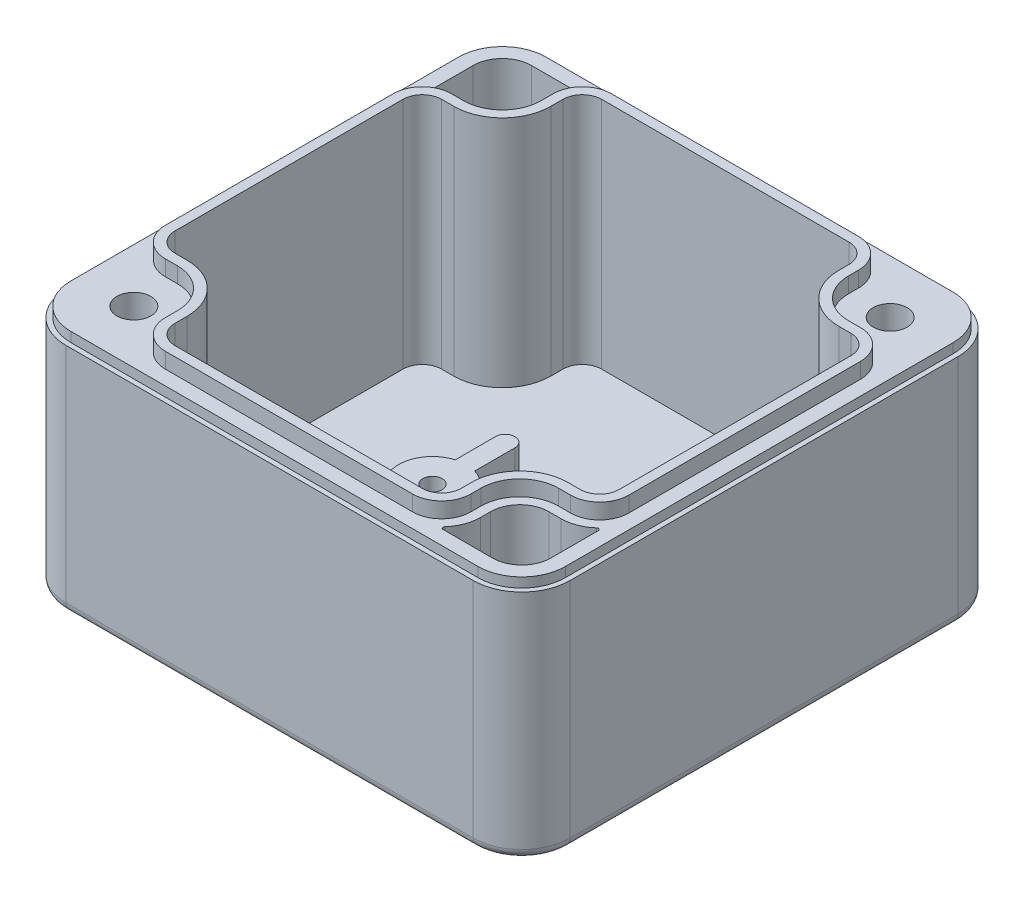
from build123d import *

# Parameters (mm, degrees)
EXTRUDE_1_DEPTH       = 25
CUT_EXTRUDE_START     = 2.5
CUT_EXTRUDE_1_DEPTH   = 22.5
CUT_EXTRUDE_START_2   = 3
CUT_EXTRUDE_3_DEPTH   = 22
EXTRUDE_START         = 25
EXTRUDE_1_2_DEPTH     = 1.6
CUT_EXTRUDE_START_3   = 25
CUT_EXTRUDE_1_2_DEPTH = 1
FILLET_1_R            = 0.2
SKETCH_9_R            = 2.25
CUT_EXTRUDE_4_DEPTH   = 4
SKETCH_10_R           = 4
CUT_EXTRUDE_5_DEPTH   = 17
FILLET_2_R            = 1
SKETCH_11_R           = 1.75
CUT_EXTRUDE_6_DEPTH   = 25
EXTRUDE_2_DEPTH       = 5.5
SKETCH_13_R           = 3.5
EXTRUDE_3_DEPTH       = 5.5
SKETCH_14_R           = 1
CUT_EXTRUDE_7_DEPTH   = 4.5


with BuildPart() as part:
    # Эскиз1 → Extrude 1 (new body)
    with BuildSketch(Plane(origin=(0, 0, 0), x_dir=(1, 0, 0), z_dir=(0, 1, 0))):
        with BuildLine():
            Line((-21, 25), (21, 25))
            ThreePointArc((21, 25), (24.535533906, 23.535533906), (26, 20))
            Line((26, 20), (26, -20))
            ThreePointArc((26, -20), (24.535533906, -23.535533906), (21, -25))
            Line((21, -25), (-21, -25))
            ThreePointArc((-21, -25), (-24.535533906, -23.535533906), (-26, -20))
            Line((-26, -20), (-26, 20))
            ThreePointArc((-26, 20), (-24.535533906, 23.535533906), (-21, 25))
        make_face()
    extrude(amount=EXTRUDE_1_DEPTH)

    # Эскиз2 → Cut-Extrude 1 (cut)
    with BuildSketch(Plane(origin=(0, 0, 0), x_dir=(1, 0, 0), z_dir=(0, 1, 0)).offset(CUT_EXTRUDE_START)):
        with BuildLine():
            Line((-14.75, 20), (-14.75, 18.75))
            ThreePointArc((-14.75, 18.75), (-16.214466094, 15.214466094), (-19.75, 13.75))
            Line((-19.75, 13.75), (-21, 13.75))
            ThreePointArc((-21, 13.75), (-22.414213562, 13.164213562), (-23, 11.75))
            Line((-23, 11.75), (-23, -11.75))
            ThreePointArc((-23, -11.75), (-22.414213562, -13.164213562), (-21, -13.75))
            Line((-21, -13.75), (-19.75, -13.75))
            ThreePointArc((-19.75, -13.75), (-16.214466094, -15.214466094), (-14.75, -18.75))
            Line((-14.75, -18.75), (-14.75, -20))
            ThreePointArc((-14.75, -20), (-14.164213562, -21.414213562), (-12.75, -22))
            Line((-12.75, -22), (12.75, -22))
            ThreePointArc((12.75, -22), (14.164213562, -21.414213562), (14.75, -20))
            Line((14.75, -20), (14.75, -18.955193866))
            ThreePointArc((14.75, -18.955193866), (16.214466094, -15.41965996), (19.75, -13.955193866))
            Line((19.75, -13.955193866), (21, -13.955193866))
            ThreePointArc((21, -13.955193866), (22.414213562, -13.369407428), (23, -11.955193866))
            Line((23, -11.955193866), (23, 11.955193866))
            ThreePointArc((23, 11.955193866), (22.414213562, 13.369407428), (21, 13.955193866))
            Line((21, 13.955193866), (19.75, 13.955193866))
            ThreePointArc((19.75, 13.955193866), (16.214466094, 15.41965996), (14.75, 18.955193866))
            Line((14.75, 18.955193866), (14.75, 20))
            ThreePointArc((14.75, 20), (14.164213562, 21.414213562), (12.75, 22))
            Line((12.75, 22), (-12.75, 22))
            ThreePointArc((-12.75, 22), (-14.164213562, 21.414213562), (-14.75, 20))
        make_face()
    extrude(amount=CUT_EXTRUDE_1_DEPTH, mode=Mode.SUBTRACT)

    # Эскиз8 → Вырез-Вытянуть3 (cut)
    with BuildSketch(Plane(origin=(0, 0, 0), x_dir=(1, 0, 0), z_dir=(0, 1, 0)).offset(CUT_EXTRUDE_START_2)):
        with BuildLine():
            Line((-24, 20), (-24, 14.395751311))
            ThreePointArc((-24, 14.395751311), (-22.645751311, 15.395751311), (-21, 15.75))
            Line((-21, 15.75), (-19.75, 15.75))
            ThreePointArc((-19.75, 15.75), (-17.628679656, 16.628679656), (-16.75, 18.75))
            Line((-16.75, 18.75), (-16.75, 20))
            ThreePointArc((-16.75, 20), (-16.395751311, 21.645751311), (-15.395751311, 23))
            Line((-15.395751311, 23), (-21, 23))
            ThreePointArc((-21, 23), (-23.121320344, 22.121320344), (-24, 20))
        make_face()
        with BuildLine():
            Line((19.75, -15.955193866), (21, -15.955193866))
            ThreePointArc((21, -15.955193866), (22.645751311, -15.600945177), (24, -14.600945177))
            Line((24, -14.600945177), (24, -20))
            ThreePointArc((24, -20), (23.121320344, -22.121320344), (21, -23))
            Line((21, -23), (15.395751311, -23))
            ThreePointArc((15.395751311, -23), (16.395751311, -21.645751311), (16.75, -20))
            Line((16.75, -20), (16.75, -18.955193866))
            ThreePointArc((16.75, -18.955193866), (17.628679656, -16.833873522), (19.75, -15.955193866))
        make_face()
    extrude(amount=CUT_EXTRUDE_3_DEPTH, mode=Mode.SUBTRACT)

    # Эскиз2<2> → Extrude 1 2 (add)
    with BuildSketch(Plane(origin=(0, 0, 0), x_dir=(1, 0, 0), z_dir=(0, 1, 0)).offset(EXTRUDE_START)):
        with BuildLine():
            Line((-19.75, 14.75), (-21, 14.75))
            ThreePointArc((-21, 14.75), (-23.121320344, 13.871320344), (-24, 11.75))
            Line((-24, 11.75), (-24, -11.75))
            ThreePointArc((-24, -11.75), (-23.121320344, -13.871320344), (-21, -14.75))
            Line((-21, -14.75), (-19.75, -14.75))
            ThreePointArc((-19.75, -14.75), (-16.921572875, -15.921572875), (-15.75, -18.75))
            Line((-15.75, -18.75), (-15.75, -20))
            ThreePointArc((-15.75, -20), (-14.871320344, -22.121320344), (-12.75, -23))
            Line((-12.75, -23), (12.75, -23))
            ThreePointArc((12.75, -23), (14.871320344, -22.121320344), (15.75, -20))
            Line((15.75, -20), (15.75, -18.955193866))
            ThreePointArc((15.75, -18.955193866), (16.921572875, -16.126766741), (19.75, -14.955193866))
            Line((19.75, -14.955193866), (21, -14.955193866))
            ThreePointArc((21, -14.955193866), (23.121320344, -14.076514209), (24, -11.955193866))
            Line((24, -11.955193866), (24, 11.955193866))
            ThreePointArc((24, 11.955193866), (23.121320344, 14.076514209), (21, 14.955193866))
            Line((21, 14.955193866), (19.75, 14.955193866))
            ThreePointArc((19.75, 14.955193866), (16.921572875, 16.126766741), (15.75, 18.955193866))
            Line((15.75, 18.955193866), (15.75, 20))
            ThreePointArc((15.75, 20), (14.871320344, 22.121320344), (12.75, 23))
            Line((12.75, 23), (-12.75, 23))
            ThreePointArc((-12.75, 23), (-14.871320344, 22.121320344), (-15.75, 20))
            Line((-15.75, 20), (-15.75, 18.75))
            ThreePointArc((-15.75, 18.75), (-16.921572875, 15.921572875), (-19.75, 14.75))
        make_face()
        with BuildLine():
            Line((-19.75, 13.75), (-21, 13.75))
            ThreePointArc((-21, 13.75), (-22.414213562, 13.164213562), (-23, 11.75))
            Line((-23, 11.75), (-23, -11.75))
            ThreePointArc((-23, -11.75), (-22.414213562, -13.164213562), (-21, -13.75))
            Line((-21, -13.75), (-19.75, -13.75))
            ThreePointArc((-19.75, -13.75), (-16.214466094, -15.214466094), (-14.75, -18.75))
            Line((-14.75, -18.75), (-14.75, -20))
            ThreePointArc((-14.75, -20), (-14.164213562, -21.414213562), (-12.75, -22))
            Line((-12.75, -22), (12.75, -22))
            ThreePointArc((12.75, -22), (14.164213562, -21.414213562), (14.75, -20))
            Line((14.75, -20), (14.75, -18.955193866))
            ThreePointArc((14.75, -18.955193866), (16.214466094, -15.41965996), (19.75, -13.955193866))
            Line((19.75, -13.955193866), (21, -13.955193866))
            ThreePointArc((21, -13.955193866), (22.414213562, -13.369407428), (23, -11.955193866))
            Line((23, -11.955193866), (23, 11.955193866))
            ThreePointArc((23, 11.955193866), (22.414213562, 13.369407428), (21, 13.955193866))
            Line((21, 13.955193866), (19.75, 13.955193866))
            ThreePointArc((19.75, 13.955193866), (16.214466094, 15.41965996), (14.75, 18.955193866))
            Line((14.75, 18.955193866), (14.75, 20))
            ThreePointArc((14.75, 20), (14.164213562, 21.414213562), (12.75, 22))
            Line((12.75, 22), (-12.75, 22))
            ThreePointArc((-12.75, 22), (-14.164213562, 21.414213562), (-14.75, 20))
            Line((-14.75, 20), (-14.75, 18.75))
            ThreePointArc((-14.75, 18.75), (-16.214466094, 15.214466094), (-19.75, 13.75))
        make_face(mode=Mode.SUBTRACT)
    extrude(amount=EXTRUDE_1_2_DEPTH)

    # Эскиз4 → Cut-Extrude 1 2 (cut)
    with BuildSketch(Plane(origin=(0, 0, 0), x_dir=(1, 0, 0), z_dir=(0, 1, 0)).offset(CUT_EXTRUDE_START_3)):
        with BuildLine():
            Line((-26.5, 20), (-26.5, -20))
            ThreePointArc((-26.5, -20), (-24.889087297, -23.889087297), (-21, -25.5))
            Line((-21, -25.5), (21, -25.5))
            ThreePointArc((21, -25.5), (24.889087297, -23.889087297), (26.5, -20))
            Line((26.5, -20), (26.5, 20))
            ThreePointArc((26.5, 20), (24.889087297, 23.889087297), (21, 25.5))
            Line((21, 25.5), (-21, 25.5))
            ThreePointArc((-21, 25.5), (-24.889087297, 23.889087297), (-26.5, 20))
        make_face()
        with BuildLine():
            Line((-25.5, 20), (-25.5, -20))
            ThreePointArc((-25.5, -20), (-24.181980515, -23.181980515), (-21, -24.5))
            Line((-21, -24.5), (21, -24.5))
            ThreePointArc((21, -24.5), (24.181980515, -23.181980515), (25.5, -20))
            Line((25.5, -20), (25.5, 20))
            ThreePointArc((25.5, 20), (24.181980515, 23.181980515), (21, 24.5))
            Line((21, 24.5), (-21, 24.5))
            ThreePointArc((-21, 24.5), (-24.181980515, 23.181980515), (-25.5, 20))
        make_face(mode=Mode.SUBTRACT)
    extrude(amount=-CUT_EXTRUDE_1_2_DEPTH, mode=Mode.SUBTRACT)

    # Скругление1
    fillet_1_edges = [part.edges().sort_by_distance(p)[0] for p in [
        (15.395751311, 14, 23),
        (24, 14, 14.600945177),
        (-15.395751311, 14, -23),
        (-24, 14, -14.395751311),
    ]]
    fillet(fillet_1_edges, radius=FILLET_1_R)

    # Эскиз9 → Вырез-Вытянуть4 (cut)
    with BuildSketch(Plane(origin=(0, 0, 0), x_dir=(1, 0, 0), z_dir=(0, 1, 0))):
        with Locations(Location((-20, 19, 0), (0, 0, 270))):
            Circle(SKETCH_9_R)
        with Locations(Location((20, -19, 0), (0, 0, 270))):
            Circle(SKETCH_9_R)
    extrude(amount=CUT_EXTRUDE_4_DEPTH, mode=Mode.SUBTRACT)

    # Эскиз10 → Вырез-Вытянуть5 (cut)
    with BuildSketch(Plane(origin=(0, 0, 0), x_dir=(1, 0, 0), z_dir=(0, 1, 0))):
        with Locations(Location((20, 19, 0), (0, 0, 270))):
            Circle(SKETCH_10_R)
        with Locations(Location((-20, -19, 0), (0, 0, 270))):
            Circle(SKETCH_10_R)
    extrude(amount=CUT_EXTRUDE_5_DEPTH, mode=Mode.SUBTRACT)

    # Скругление2
    fillet_2_edges = [part.edges().sort_by_distance(p)[0] for p in [
        (0, 0, -25),
        (24.535533906, 0, -23.535533906),
        (26, 0, 0),
        (24.535533906, 0, 23.535533906),
        (0, 0, 25),
        (-24.535533906, 0, 23.535533906),
        (-26, 0, 0),
        (-24.535533906, 0, -23.535533906),
    ]]
    fillet(fillet_2_edges, radius=FILLET_2_R)

    # Эскиз11 → Вырез-Вытянуть6 (cut)
    with BuildSketch(Plane(origin=(0, 0, 0), x_dir=(1, 0, 0), z_dir=(0, 1, 0))):
        with Locations(Location((-20, -19, 0), (0, 0, 90))):
            Circle(SKETCH_11_R)
        with Locations(Location((20, 19, 0), (0, 0, 90))):
            Circle(SKETCH_11_R)
    extrude(amount=CUT_EXTRUDE_6_DEPTH, mode=Mode.SUBTRACT)

    # Эскиз12 → Бобышка-Вытянуть2 (add)
    with BuildSketch(Plane(origin=(0, 0, 0), x_dir=(1, 0, 0), z_dir=(0, 1, 0))):
        with BuildLine():
            Line((-7.2, 7.5), (-7.2, -7.5))
            ThreePointArc((-7.2, -7.5), (-8.2, -8.5), (-9.2, -7.5))
            Line((-9.2, -7.5), (-9.2, 7.5))
            ThreePointArc((-9.2, 7.5), (-8.2, 8.5), (-7.2, 7.5))
        make_face()
    extrude_2 = extrude(amount=EXTRUDE_2_DEPTH)

    # Эскиз13 → Бобышка-Вытянуть3 (add)
    with BuildSketch(Plane(origin=(0, 0, 0), x_dir=(1, 0, 0), z_dir=(0, 1, 0))):
        with Locations((-8.2, 0)):
            Circle(SKETCH_13_R)
    extrude_3 = extrude(amount=EXTRUDE_3_DEPTH)

    # Эскиз14 → Вырез-Вытянуть7 (cut)
    with BuildSketch(Plane(origin=(0, 5.5, 0), x_dir=(1, 0, 0), z_dir=(0, 1, 0))):
        with Locations(Location((-8.2, 0, 0), (0, 0, 270))):
            Circle(SKETCH_14_R)
    cut_extrude_7 = extrude(amount=-CUT_EXTRUDE_7_DEPTH, mode=Mode.SUBTRACT)

    # Зеркальное отражение1: Бобышка-Вытянуть2, Бобышка-Вытянуть3, Вырез-Вытянуть7 across plane
    add(extrude_2.mirror(Plane(origin=(0, 0, 0), x_dir=(0, 0, 1), z_dir=(1, 0, 0))))
    add(extrude_3.mirror(Plane(origin=(0, 0, 0), x_dir=(0, 0, 1), z_dir=(1, 0, 0))))
    add(cut_extrude_7.mirror(Plane(origin=(0, 0, 0), x_dir=(0, 0, 1), z_dir=(1, 0, 0))), mode=Mode.SUBTRACT)


solid = part.part
